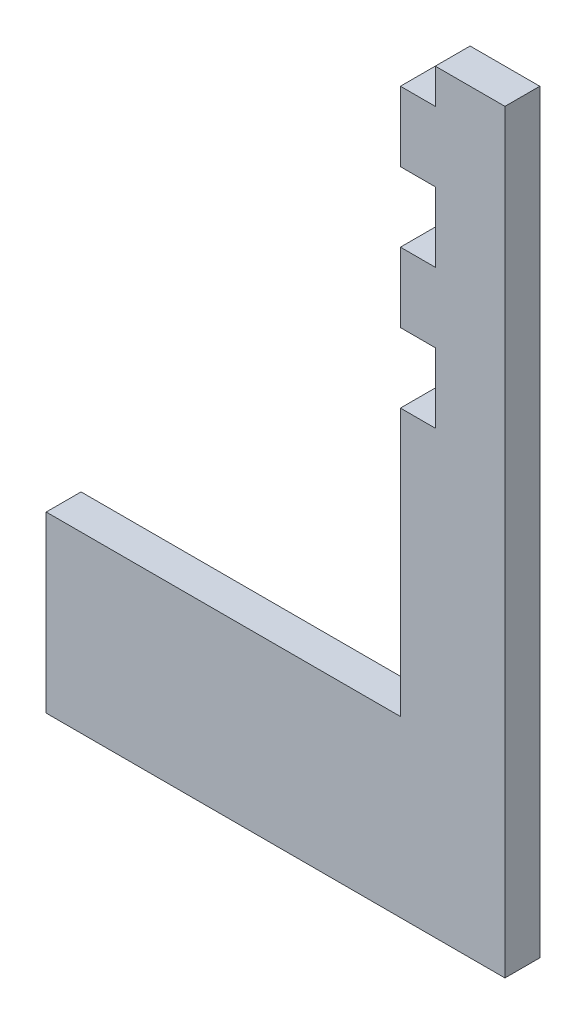
from build123d import *

# Parameters (mm, degrees)
SKETCH1_W           = 18
SKETCH1_H           = 100
BOSS_EXTRUDE4_DEPTH = 6
BOSS_EXTRUDE5_DEPTH = 6
CUT_EXTRUDE1_REACH  = 129.581
SKETCH4_W           = 6
SKETCH4_H           = 12


with BuildPart() as part:
    # Sketch1 → Boss-Extrude4 (new body)
    with BuildSketch(Plane.XY):
        with Locations((70, 50)):
            Rectangle(SKETCH1_W, SKETCH1_H)
    extrude(amount=BOSS_EXTRUDE4_DEPTH)

    # Sketch1<8> → Boss-Extrude5 (add)
    with BuildSketch(Plane.XY):
        Polygon((79, -30), (79, 0), (61, 0), (20, 0), (0, 0), (0, -30), align=None)
    extrude(amount=BOSS_EXTRUDE5_DEPTH)

    # Sketch4 → Cut-Extrude1 (cut, up to next)
    with BuildSketch(Plane(origin=(0, 0, 0), x_dir=(-1, 0, 0), z_dir=(0, 0, -1)), mode=Mode.PRIVATE) as cut_extrude1_sk1:
        with Locations((-64, 100)):
            Rectangle(SKETCH4_W, SKETCH4_H)
    cut_extrude1_tool1 = extrude(cut_extrude1_sk1.sketch, amount=-CUT_EXTRUDE1_REACH, mode=Mode.PRIVATE) & part.part
    # Sketch4 → Cut-Extrude1 (cut, up to next)
    with BuildSketch(Plane(origin=(0, 0, 0), x_dir=(-1, 0, 0), z_dir=(0, 0, -1)), mode=Mode.PRIVATE) as cut_extrude1_sk2:
        with Locations((-64, 76)):
            Rectangle(SKETCH4_W, SKETCH4_H)
    cut_extrude1_tool2 = extrude(cut_extrude1_sk2.sketch, amount=-CUT_EXTRUDE1_REACH, mode=Mode.PRIVATE) & part.part
    # Sketch4 → Cut-Extrude1 (cut, up to next)
    with BuildSketch(Plane(origin=(0, 0, 0), x_dir=(-1, 0, 0), z_dir=(0, 0, -1)), mode=Mode.PRIVATE) as cut_extrude1_sk3:
        with Locations((-64, 52)):
            Rectangle(SKETCH4_W, SKETCH4_H)
    cut_extrude1_tool3 = extrude(cut_extrude1_sk3.sketch, amount=-CUT_EXTRUDE1_REACH, mode=Mode.PRIVATE) & part.part
    add(cut_extrude1_tool1.solids().sort_by_distance((64, 100, 0))[0], mode=Mode.SUBTRACT)
    add(cut_extrude1_tool2.solids().sort_by_distance((64, 76, 0))[0], mode=Mode.SUBTRACT)
    add(cut_extrude1_tool3.solids().sort_by_distance((64, 52, 0))[0], mode=Mode.SUBTRACT)


solid = part.part
